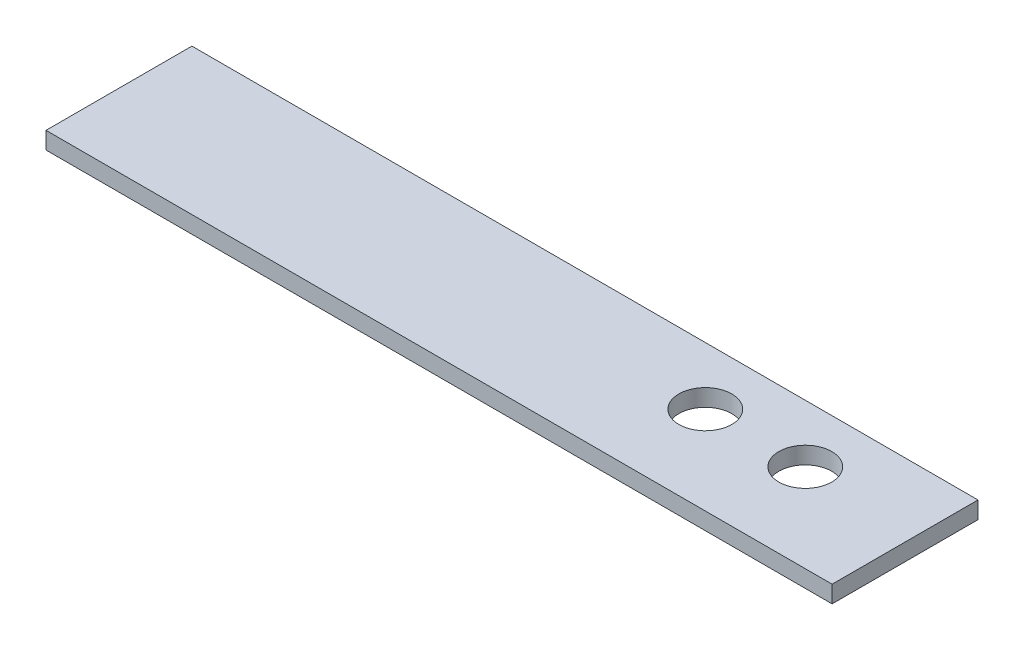
from build123d import *

# Parameters (mm, degrees)
SKETCH1_W           = 876.3
SKETCH1_H           = 162.639355696
BOSS_EXTRUDE1_DEPTH = 19.05
SKETCH3_R           = 29.499999928
CUT_EXTRUDE1_DEPTH  = 19.05
SKETCH2_R           = 29.499999928
CUT_EXTRUDE2_DEPTH  = 19.05


with BuildPart() as part:
    # Sketch1 → Boss-Extrude1 (new body)
    with BuildSketch(Plane(origin=(0, 0, 0), x_dir=(1, 0, 0), z_dir=(0, 1, 0))):
        with Locations((375.34945696, 65.501495954)):
            Rectangle(SKETCH1_W, SKETCH1_H)
    extrude(amount=BOSS_EXTRUDE1_DEPTH)

    # Sketch3 → Cut-Extrude1 (cut)
    with BuildSketch(Plane(origin=(0, 19.05, 0), x_dir=(1, 0, 0), z_dir=(0, 1, 0))):
        with Locations(Location((573.905935058, 82.4588113, 0), (0, 0, 270))):
            Circle(SKETCH3_R)
    extrude(amount=-CUT_EXTRUDE1_DEPTH, mode=Mode.SUBTRACT)

    # Sketch2 → Cut-Extrude2 (cut)
    with BuildSketch(Plane(origin=(0, 19.05, 0), x_dir=(1, 0, 0), z_dir=(0, 1, 0))):
        with Locations(Location((685.24027425, 82.567946762, 0), (0, 0, 270))):
            Circle(SKETCH2_R)
    extrude(amount=-CUT_EXTRUDE2_DEPTH, mode=Mode.SUBTRACT)


solid = part.part
